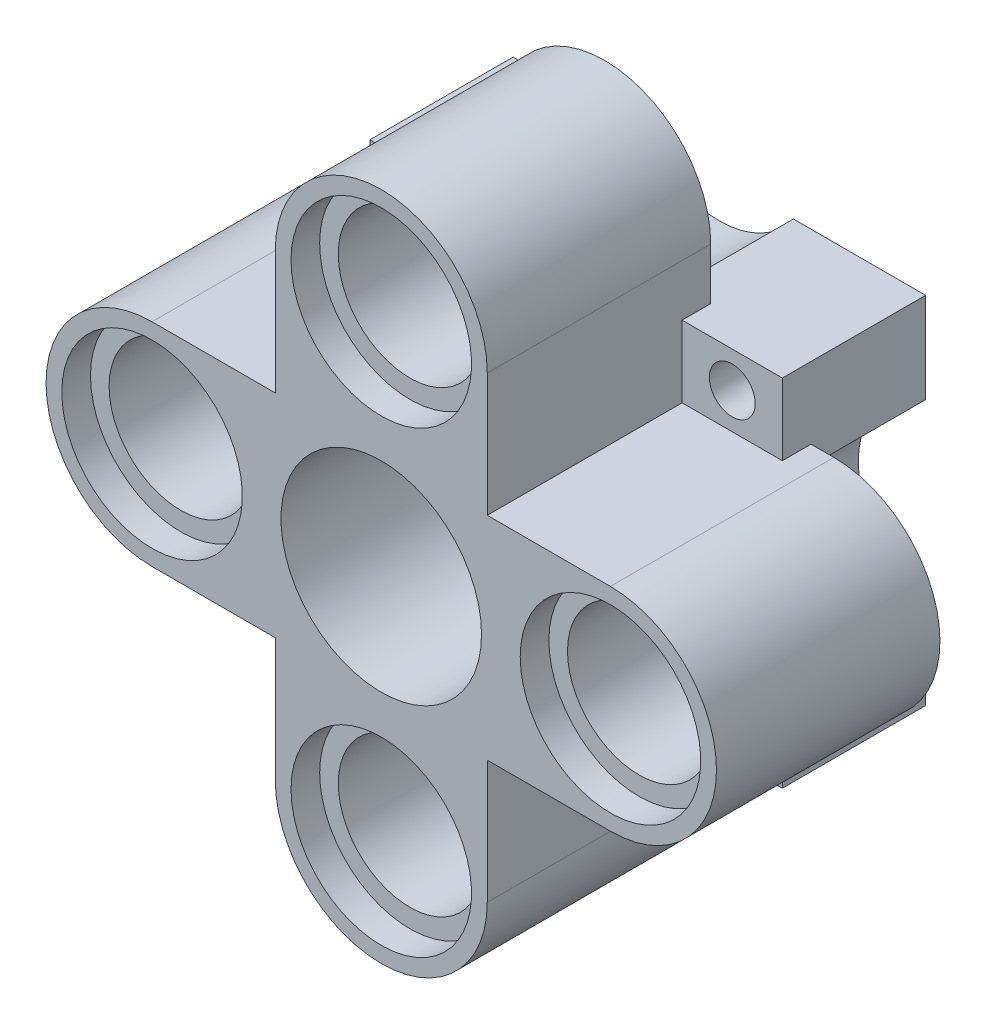
from build123d import *

# Parameters (mm, degrees)
SKETCH_2_W          = 23.4
SKETCH_2_H          = 7.4
SKETCH_2_W_2        = 7.4
SKETCH_2_H_2        = 23.4
EXTRUDE_1_DEPTH     = 7.8
EXTRUDE_START       = -1
SKETCH_3_W          = 14.4
SKETCH_3_H          = 12.4
EXTRUDE_2_DEPTH     = 5
SKETCH_2_6_R        = 2.5
SKETCH_2_6_R_2      = 3.5
CUT_EXTRUDE_3_DEPTH = 19.292621463
SKETCH_2_3_R        = 3.15
CUT_EXTRUDE_1_DEPTH = 1
CUT_EXTRUDE_START   = 6.8
SKETCH_2_5_R        = 3.15
CUT_EXTRUDE_2_DEPTH = 1
SKETCH_4_R          = 0.8
CUT_EXTRUDE_4_DEPTH = 21.322893495
SKETCH_2_7_R        = 3.5
SKETCH_2_7_R_2      = 3.15
CUT_EXTRUDE_5_DEPTH = 19.292621463


with BuildPart() as part:
    # 草图2 → 凸台-拉伸1 (new body)
    with BuildSketch(Plane.XY):
        Rectangle(SKETCH_2_W, SKETCH_2_H)
        Rectangle(SKETCH_2_W_2, SKETCH_2_H_2)
    extrude(amount=EXTRUDE_1_DEPTH)

    # 草图3 → 凸台-拉伸2 (add)
    with BuildSketch(Plane(origin=(0, 0, 0), x_dir=(-1, 0, 0), z_dir=(0, 0, -1)).offset(EXTRUDE_START)):
        Rectangle(SKETCH_3_W, SKETCH_3_H)
    extrude(amount=EXTRUDE_2_DEPTH)

    # 草图2<6> → 切除-拉伸3 (cut, through all)
    with BuildSketch(Plane.XY):
        with BuildLine():
            Line((-3.7, 11.7), (-3.7, 8))
            ThreePointArc((-3.7, 8), (-2.61629509, 10.61629509), (0, 11.7))
            Line((0, 11.7), (-3.7, 11.7))
        make_face()
        with BuildLine():
            ThreePointArc((0, 11.7), (2.61629509, 10.61629509), (3.7, 8))
            Line((3.7, 8), (3.7, 11.7))
            Line((3.7, 11.7), (0, 11.7))
        make_face()
        with BuildLine():
            Line((11.7, 3.7), (8.000000006, 3.7))
            ThreePointArc((8.000000006, 3.7), (10.616295093, 2.616295088), (11.7, 0))
            Line((11.7, 0), (11.7, 3.7))
        make_face()
        with BuildLine():
            ThreePointArc((11.7, 0), (10.616295085, -2.616295096), (7.999999984, -3.7))
            Line((7.999999984, -3.7), (11.7, -3.7))
            Line((11.7, -3.7), (11.7, 0))
        make_face()
        with BuildLine():
            Line((3.7, -11.7), (3.7, -8))
            ThreePointArc((3.7, -8), (2.61629509, -10.61629509), (0, -11.7))
            Line((0, -11.7), (3.7, -11.7))
        make_face()
        with BuildLine():
            ThreePointArc((0, -11.7), (-2.616295094, -10.616295087), (-3.7, -7.99999999))
            Line((-3.7, -7.99999999), (-3.7, -11.7))
            Line((-3.7, -11.7), (0, -11.7))
        make_face()
        with BuildLine():
            Line((-11.7, -1.1e-08), (-11.7, -3.7))
            Line((-11.7, -3.7), (-8.000000004, -3.7))
            ThreePointArc((-8.000000004, -3.7), (-10.616295088, -2.616295093), (-11.7, -1.1e-08))
        make_face()
        with BuildLine():
            Line((-11.7, 3.7), (-11.7, -1.1e-08))
            ThreePointArc((-11.7, -1.1e-08), (-10.616295094, 2.616295086), (-8, 3.7))
            Line((-8, 3.7), (-11.7, 3.7))
        make_face()
        with Locations(Location((0, 8, 0), (0, 0, 226.054480438))):
            Circle(SKETCH_2_6_R)
        with Locations(Location((-8, 0, 0), (0, 0, 288.662924885))):
            Circle(SKETCH_2_6_R)
        Circle(SKETCH_2_6_R_2)
        with Locations(Location((8, 0, 0), (0, 0, 108.662924885))):
            Circle(SKETCH_2_6_R)
        with Locations(Location((0, -8, 0), (0, 0, 133.945519562))):
            Circle(SKETCH_2_6_R)
    extrude(amount=CUT_EXTRUDE_3_DEPTH, mode=Mode.SUBTRACT)

    # 草图2<3> → 切除-拉伸1 (cut)
    with BuildSketch(Plane.XY):
        with Locations(Location((8, 0, 0), (0, 0, 255.287542039))):
            Circle(SKETCH_2_3_R)
        with Locations(Location((-8, 0, 0), (0, 0, 284.712457961))):
            Circle(SKETCH_2_3_R)
        with Locations(Location((0, 8, 0), (0, 0, 214.849904579))):
            Circle(SKETCH_2_3_R)
        with Locations(Location((0, -8, 0), (0, 0, 145.150095421))):
            Circle(SKETCH_2_3_R)
    extrude(amount=CUT_EXTRUDE_1_DEPTH, mode=Mode.SUBTRACT)

    # 草图2<5> → 切除-拉伸2 (cut)
    with BuildSketch(Plane.XY.offset(CUT_EXTRUDE_START)):
        with Locations(Location((8, 0, 0), (0, 0, 255.287542039))):
            Circle(SKETCH_2_5_R)
        with Locations(Location((-8, 0, 0), (0, 0, 284.712457961))):
            Circle(SKETCH_2_5_R)
        with Locations(Location((0, 8, 0), (0, 0, 214.849904579))):
            Circle(SKETCH_2_5_R)
        with Locations(Location((0, -8, 0), (0, 0, 145.150095421))):
            Circle(SKETCH_2_5_R)
    extrude(amount=CUT_EXTRUDE_2_DEPTH, mode=Mode.SUBTRACT)

    # 草图4 → 切除-拉伸4 (cut, through all)
    with BuildSketch(Plane(origin=(0, 0, -4), x_dir=(-1, 0, 0), z_dir=(0, 0, -1))):
        with Locations((5.45, 4.95)):
            Circle(SKETCH_4_R)
        with Locations((-5.45, 4.95)):
            Circle(SKETCH_4_R)
        with Locations((5.45, -4.95)):
            Circle(SKETCH_4_R)
        with Locations((-5.45, -4.95)):
            Circle(SKETCH_4_R)
    extrude(amount=-CUT_EXTRUDE_4_DEPTH, mode=Mode.SUBTRACT)

    # 草图2<7> → 切除-拉伸5 (cut, through all)
    with BuildSketch(Plane.XY):
        Circle(SKETCH_2_7_R)
        with Locations(Location((8, 0, 0), (0, 0, 104.712457961))):
            Circle(SKETCH_2_7_R_2)
        with Locations(Location((-8, 0, 0), (0, 0, 284.712457961))):
            Circle(SKETCH_2_7_R_2)
        with Locations(Location((0, 8, 0), (0, 0, 214.849904579))):
            Circle(SKETCH_2_7_R_2)
        with Locations(Location((0, -8, 0), (0, 0, 145.150095421))):
            Circle(SKETCH_2_7_R_2)
    extrude(amount=-CUT_EXTRUDE_5_DEPTH, mode=Mode.SUBTRACT)


solid = part.part
